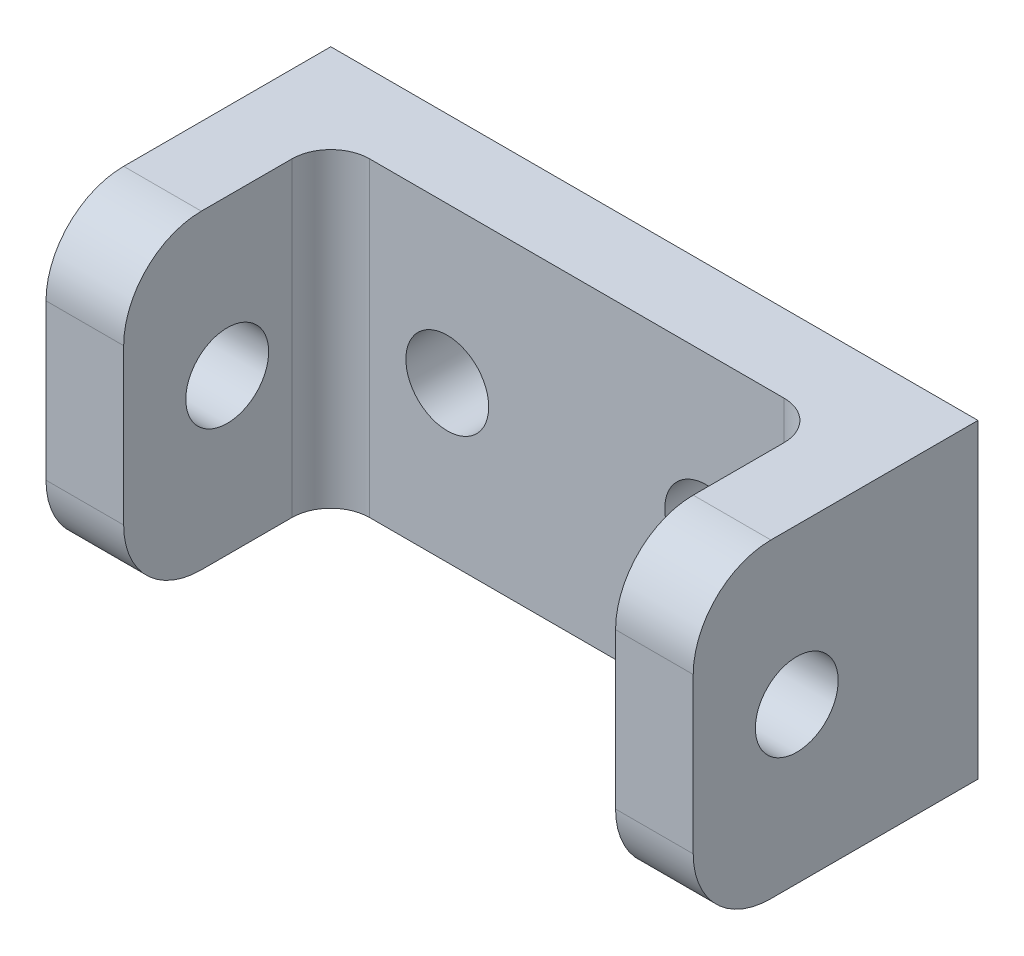
from build123d import *

# Parameters (mm, degrees)
SKETCH_1_W             = 25
SKETCH_1_H             = 12
EXTRUDE_1_DEPTH        = 3
SKETCH_2_W             = 8
SKETCH_2_H             = 12
EXTRUDE_2_DEPTH        = 3
FILLET_1_R             = 3
FILLET_2_R             = 1.5
SKETCH_3_R             = 1.6
CUT_EXTRUDE_1_DEPTH    = 3
FILLET_1_OF_MIRROR_1_R = 3
FILLET_2_OF_MIRROR_1_R = 1.5
SKETCH_4_R             = 1.6
CUT_EXTRUDE_2_DEPTH    = 3


with BuildPart() as part:
    # 草图1 → 凸台-拉伸1 (new body)
    with BuildSketch(Plane.XY):
        with Locations((0, -24)):
            Rectangle(SKETCH_1_W, SKETCH_1_H)
    extrude(amount=EXTRUDE_1_DEPTH)

    # 草图2 → 凸台-拉伸2 (add)
    with BuildSketch(Plane.ZY.offset(12.5)):
        with Locations((7, -24)):
            Rectangle(SKETCH_2_W, SKETCH_2_H)
    extrude_2 = extrude(amount=-EXTRUDE_2_DEPTH)

    # 圆角1
    fillet_1_edges = [part.edges().sort_by_distance(p)[0] for p in [
        (-11, -18, 11),
        (-11, -30, 11),
    ]]
    fillet(fillet_1_edges, radius=FILLET_1_R)

    # 圆角2
    fillet_2_edges = [part.edges().sort_by_distance(p)[0] for p in [
        (-9.5, -24, 3),
    ]]
    fillet(fillet_2_edges, radius=FILLET_2_R)

    # 草图3 → 切除-拉伸1 (cut)
    with BuildSketch(Plane.ZY.offset(12.5)):
        with Locations(Location((7, -24, 0), (0, 0, 270))):
            Circle(SKETCH_3_R)
    cut_extrude_1 = extrude(amount=-CUT_EXTRUDE_1_DEPTH, mode=Mode.SUBTRACT)

    # 镜向1: 凸台-拉伸2, 切除-拉伸1 across plane
    add(extrude_2.mirror(Plane(origin=(0, 0, 0), x_dir=(0, 0, 1), z_dir=(1, 0, 0))))
    add(cut_extrude_1.mirror(Plane(origin=(0, 0, 0), x_dir=(0, 0, 1), z_dir=(1, 0, 0))), mode=Mode.SUBTRACT)

    # 圆角1 of 镜向1
    fillet_1_of_mirror_1_edges = [part.edges().sort_by_distance(p)[0] for p in [
        (11, -18, 11),
        (11, -30, 11),
    ]]
    fillet(fillet_1_of_mirror_1_edges, radius=FILLET_1_OF_MIRROR_1_R)

    # 圆角2 of 镜向1
    fillet_2_of_mirror_1_edges = [part.edges().sort_by_distance(p)[0] for p in [
        (9.5, -24, 3),
    ]]
    fillet(fillet_2_of_mirror_1_edges, radius=FILLET_2_OF_MIRROR_1_R)

    # 草图4 → 切除-拉伸2 (cut)
    with BuildSketch(Plane.XY.offset(3)):
        with Locations((5, -24)):
            Circle(SKETCH_4_R)
        with Locations((-5, -24)):
            Circle(SKETCH_4_R)
    extrude(amount=-CUT_EXTRUDE_2_DEPTH, mode=Mode.SUBTRACT)


solid = part.part
